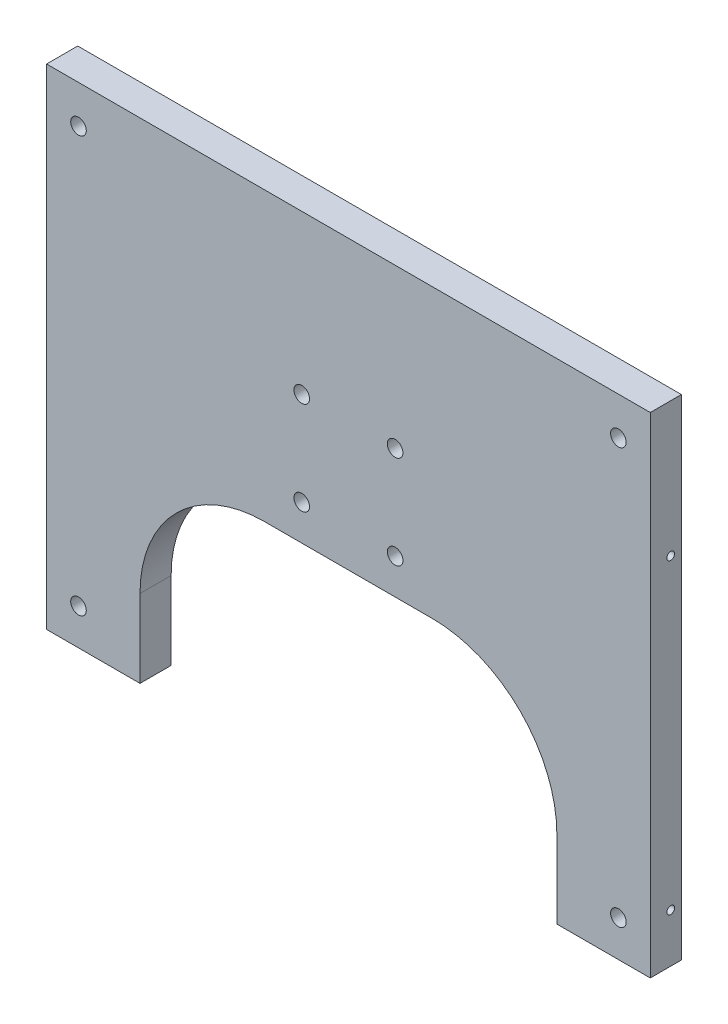
from build123d import *

# Parameters (mm, degrees)
BOSS_EXTRUDE1_DEPTH         = 12.7
F_1_4_0_25_DIAMETER_HOLE1_D = 6.35
FILLET2_R                   = 50.8
HOLE1_AT_2_COUNT            = 2
HOLE1_AT_2_PITCH            = 125.108514383


with BuildPart() as part:
    # Sketch1 → Boss-Extrude1 (new body)
    with BuildSketch(Plane.XY):
        Polygon((258.933482757, 10.713854335), (12.7, 10.713854335), (12.7, -189.051843155), (50.8, -189.051843155), (50.8, -106.501843155), (220.833482757, -106.501843155), (220.833482757, -189.051843155), (258.933482757, -189.051843155), align=None)
    extrude(amount=-BOSS_EXTRUDE1_DEPTH)

    # 1/4 (0.25) Diameter Hole1 (through all)
    with Locations(Plane(origin=(0, 0, -12.7), x_dir=(-1, 0, 0), z_dir=(0, 0, -1))):
        with Locations((-25.706162889, -174.233423282), (-116.766741379, -92.064314729), (-154.866741379, -92.064314729), (-245.927319868, -174.233423282), (-154.866741379, -53.964314729), (-245.927319868, -4.747970506), (-116.766741379, -53.964314729), (-25.706162889, -4.747970506)):
            Hole(F_1_4_0_25_DIAMETER_HOLE1_D / 2)

    # Fillet2
    fillet2_edges = [part.edges().sort_by_distance(p)[0] for p in [
        (220.833482757, -106.501843155, -6.35),
        (50.8, -106.501843155, -6.35),
    ]]
    fillet(fillet2_edges, radius=FILLET2_R)

    # Sketch7 → Hole1 (revolve, cut)
    with BuildSketch(Plane(origin=(0, -169.225348004, -8.347094202), x_dir=(0, 0, 1), z_dir=(0, 1, 0))):
        Polygon((0, 0), (0, 39.053866233), (1.5875, 38.1), (1.5875, 4.017661662), (5.08, 0), align=None)
    hole1 = revolve(axis=Axis((-14.308894879, -169.225348004, -8.347094202), (1, 0, 0)), mode=Mode.SUBTRACT)

    # Hole1 at 2: Hole1 ×2
    with Locations(*[(0, i * HOLE1_AT_2_PITCH, 0) for i in range(1, HOLE1_AT_2_COUNT)]):
        add(hole1, mode=Mode.SUBTRACT)

    # Mirror1: Hole1 across plane
    add(hole1.mirror(Plane.ZY.offset(-135.816741379)), mode=Mode.SUBTRACT)

    # Mirror1 copy 1 sketch → Mirror1 copy 1 (revolve, cut)
    with BuildSketch(Plane(origin=(271.633482757, -44.116833621, -8.347094202), x_dir=(0, 0, 1), z_dir=(0, 1, 0))):
        Polygon((0, 0), (0, -39.053866233), (1.5875, -38.1), (1.5875, -4.017661662), (5.08, 0), align=None)
    revolve(axis=Axis((285.942377636, -44.116833621, -8.347094202), (1, 0, 0)), mode=Mode.SUBTRACT)


solid = part.part
